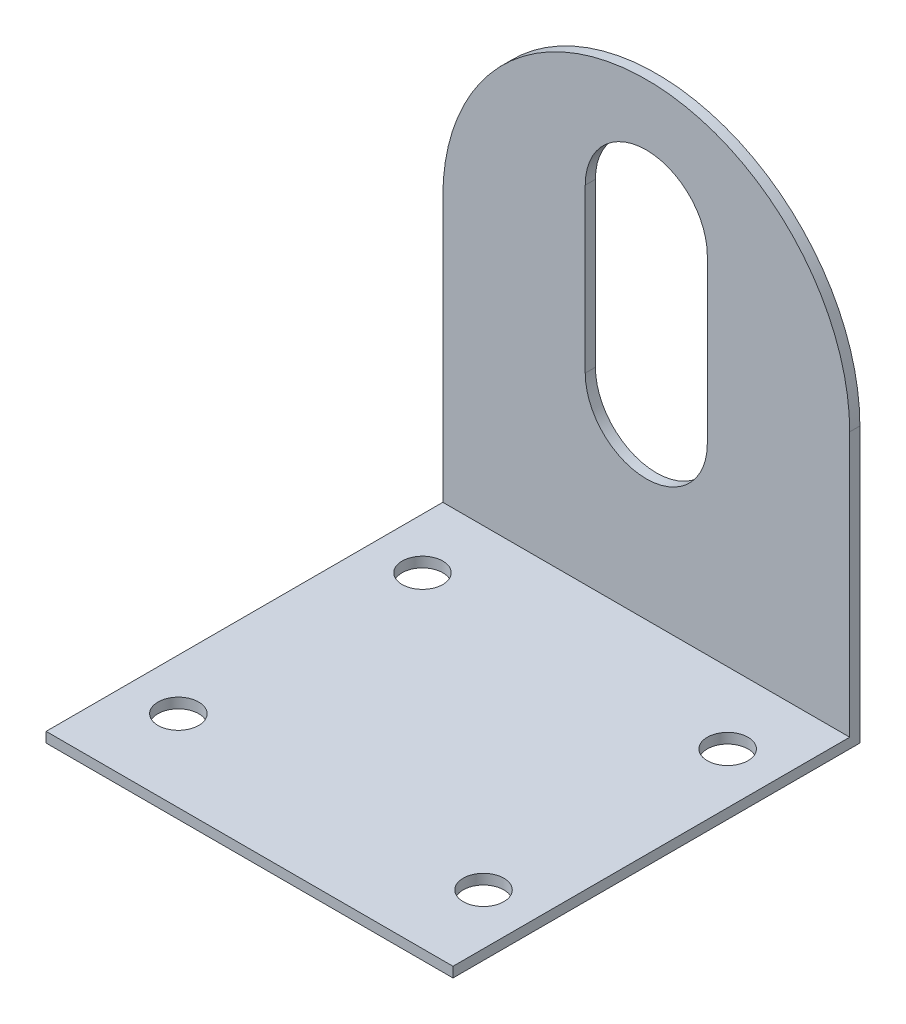
from build123d import *

# Parameters (mm, degrees)
SKETCH1_W           = 40
SKETCH1_H           = 40
SKETCH1_R           = 2
BOSS_EXTRUDE1_DEPTH = 1
SKETCH2_W           = 40
SKETCH2_H           = 1
BOSS_EXTRUDE2_DEPTH = 46
CUT_EXTRUDE1_DEPTH  = 46


with BuildPart() as part:
    # Sketch1 → Boss-Extrude1 (new body)
    with BuildSketch(Plane(origin=(0, 0, 0), x_dir=(1, 0, 0), z_dir=(0, 1, 0))):
        Rectangle(SKETCH1_W, SKETCH1_H)
        with Locations(Location((-15, -12, 0), (0, 0, 270))):
            Circle(SKETCH1_R, mode=Mode.SUBTRACT)
        with Locations(Location((15, -12, 0), (0, 0, 270))):
            Circle(SKETCH1_R, mode=Mode.SUBTRACT)
        with Locations(Location((15, 12, 0), (0, 0, 270))):
            Circle(SKETCH1_R, mode=Mode.SUBTRACT)
        with Locations(Location((-15, 12, 0), (0, 0, 270))):
            Circle(SKETCH1_R, mode=Mode.SUBTRACT)
    extrude(amount=BOSS_EXTRUDE1_DEPTH)

    # Sketch2 → Boss-Extrude2 (add)
    with BuildSketch(Plane(origin=(0, 1, 0), x_dir=(1, 0, 0), z_dir=(0, 1, 0))):
        with Locations((0, 19.5)):
            Rectangle(SKETCH2_W, SKETCH2_H)
    extrude(amount=BOSS_EXTRUDE2_DEPTH)

    # Sketch3 → Cut-Extrude1 (cut)
    with BuildSketch(Plane.XY.offset(-19)):
        with BuildLine():
            Line((6, 19), (6, 35))
            ThreePointArc((6, 35), (0, 41), (-6, 35))
            Line((-6, 35), (-6, 19))
            ThreePointArc((-6, 19), (0, 13), (6, 19))
        make_face()
        with BuildLine():
            Line((-20, 47), (-20, 27))
            ThreePointArc((-20, 27), (-14.142135559, 41.142135688), (1.83e-07, 47))
            Line((1.83e-07, 47), (-20, 47))
        make_face()
        with BuildLine():
            ThreePointArc((1.83e-07, 47), (14.142135688, 41.142135559), (20, 27))
            Line((20, 27), (20, 47))
            Line((20, 47), (1.83e-07, 47))
        make_face()
    extrude(amount=-CUT_EXTRUDE1_DEPTH, mode=Mode.SUBTRACT)


solid = part.part
